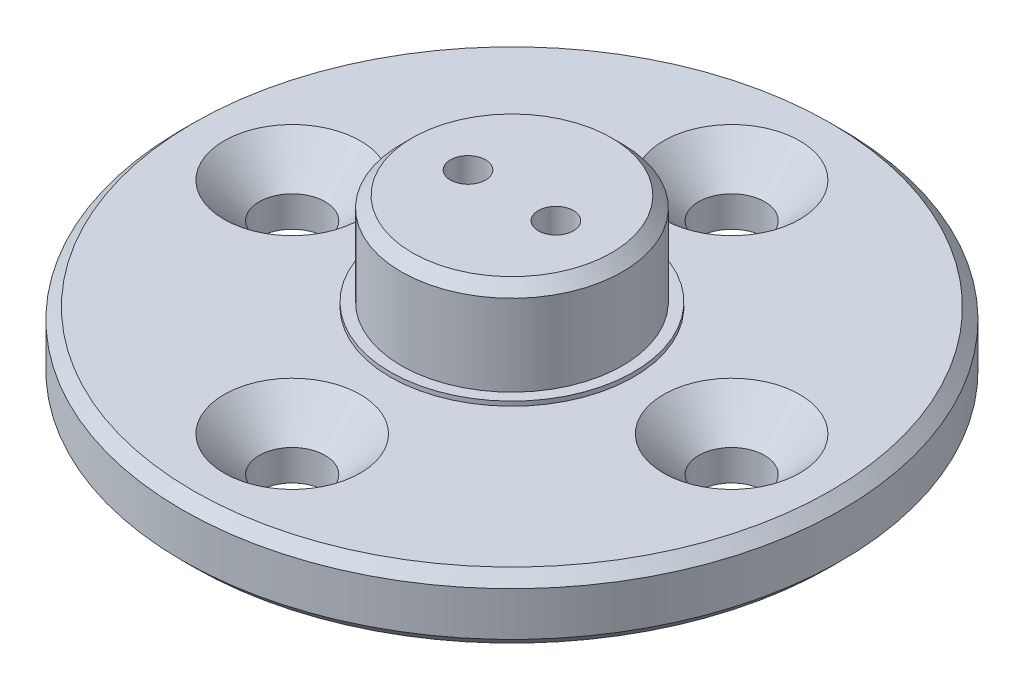
from build123d import *

# Parameters (mm, degrees)
SKETCH_1_R          = 15
SKETCH_1_R_2        = 1.5
EXTRUDE_1_DEPTH     = 3
SKETCH_2_R          = 5.035
SKETCH_2_R_2        = 0.8
EXTRUDE_2_DEPTH     = 4.4
SKETCH_4_R          = 5.535
EXTRUDE_3_DEPTH     = 0.2
CHAMFER_1_SIZE      = 0.5
CHAMFER_3_SIZE      = 0.5
CHAMFER_4_SIZE      = 1.6
CUT_EXTRUDE_START   = -10
SKETCH_5_R          = 0.8
CUT_EXTRUDE_1_DEPTH = 10


with BuildPart() as part:
    # 草图1 → 凸台-拉伸1 (new body)
    with BuildSketch(Plane(origin=(0, 0, 0), x_dir=(1, 0, 0), z_dir=(0, 1, 0))):
        with Locations(Location((0, 0, 0), (0, 0, 270))):
            Circle(SKETCH_1_R)
        with Locations(Location((0, 10, 0), (0, 0, 270))):
            Circle(SKETCH_1_R_2, mode=Mode.SUBTRACT)
        with Locations(Location((10, 0, 0), (0, 0, 270))):
            Circle(SKETCH_1_R_2, mode=Mode.SUBTRACT)
        with Locations(Location((0, -10, 0), (0, 0, 270))):
            Circle(SKETCH_1_R_2, mode=Mode.SUBTRACT)
        with Locations(Location((-10, 0, 0), (0, 0, 270))):
            Circle(SKETCH_1_R_2, mode=Mode.SUBTRACT)
    extrude(amount=EXTRUDE_1_DEPTH)

    # 草图2 → 凸台-拉伸2 (add)
    with BuildSketch(Plane(origin=(0, 3, 0), x_dir=(1, 0, 0), z_dir=(0, 1, 0))):
        with Locations(Location((0, 0, 0), (0, 0, 270))):
            Circle(SKETCH_2_R)
        with Locations(Location((2, 0, 0), (0, 0, 270))):
            Circle(SKETCH_2_R_2, mode=Mode.SUBTRACT)
        with Locations(Location((-2, 0, 0), (0, 0, 90))):
            Circle(SKETCH_2_R_2, mode=Mode.SUBTRACT)
    extrude(amount=EXTRUDE_2_DEPTH)

    # 草图4 → 凸台-拉伸3 (add)
    with BuildSketch(Plane(origin=(0, 3, 0), x_dir=(1, 0, 0), z_dir=(0, 1, 0))):
        with Locations(Location((0, 0, 0), (0, 0, 270))):
            Circle(SKETCH_4_R)
    extrude(amount=EXTRUDE_3_DEPTH)

    # 倒角1
    chamfer_1_edges = [part.edges().sort_by_distance(p)[0] for p in [
        (0, 7.4, -5.035),
    ]]
    chamfer(chamfer_1_edges, length=CHAMFER_1_SIZE)

    # 倒角3
    chamfer_3_edges = [part.edges().sort_by_distance(p)[0] for p in [
        (0, 0, -15),
        (0, 3, -15),
    ]]
    chamfer(chamfer_3_edges, length=CHAMFER_3_SIZE)

    # 倒角4
    chamfer_4_edges = [part.edges().sort_by_distance(p)[0] for p in [
        (0, 3, 8.5),
        (-10, 3, -1.5),
        (0, 3, -11.5),
        (10, 3, -1.5),
    ]]
    chamfer(chamfer_4_edges, length=CHAMFER_4_SIZE)

    # 草图5 → 切除-拉伸1 (cut)
    with BuildSketch(Plane(origin=(0, 7.4, 0), x_dir=(1, 0, 0), z_dir=(0, 1, 0)).offset(CUT_EXTRUDE_START)):
        with Locations(Location((2, 0, 0), (0, 0, 270))):
            Circle(SKETCH_5_R)
        with Locations(Location((-2, 0, 0), (0, 0, 90))):
            Circle(SKETCH_5_R)
    extrude(amount=CUT_EXTRUDE_1_DEPTH, mode=Mode.SUBTRACT)


solid = part.part
